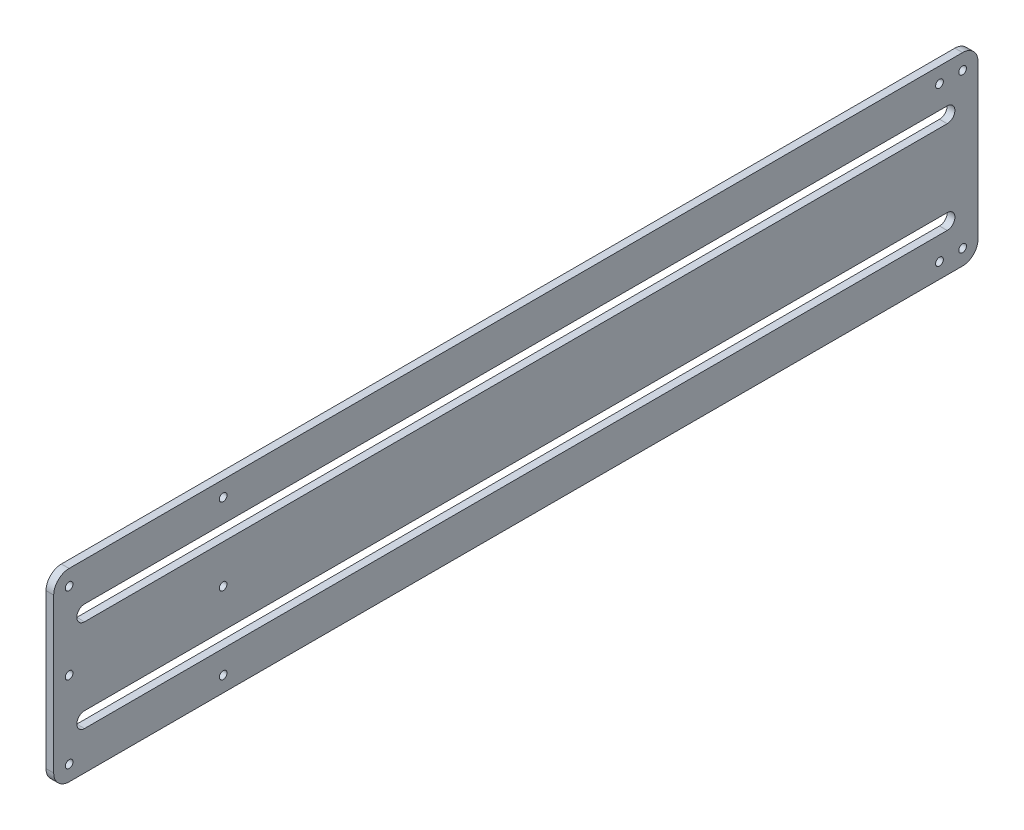
from build123d import *

# Parameters (mm, degrees)
OUTER_CUT_DEPTH    = 1.5875
SLOTS_DEPTH        = 195.298586266
SKETCH3_R          = 1.5875
MOUNT_HOLES_DEPTH  = 195.298586266
SKETCH4_R          = 1.5875
CUT_EXTRUDE1_DEPTH = 195.298586266


with BuildPart() as part:
    # Sketch1 → Outer Cut (new, symmetric)
    with BuildSketch(Plane(origin=(0, 0, 0), x_dir=(0, 0, -1), z_dir=(1, 0, 0))):
        with BuildLine():
            Line((-184.15, -38.1), (184.15, -38.1))
            ThreePointArc((184.15, -38.1), (188.640128061, -36.240128061), (190.5, -31.75))
            Line((190.5, -31.75), (190.5, 31.75))
            ThreePointArc((190.5, 31.75), (188.640128061, 36.240128061), (184.15, 38.1))
            Line((184.15, 38.1), (-184.15, 38.1))
            ThreePointArc((-184.15, 38.1), (-188.640128061, 36.240128061), (-190.5, 31.75))
            Line((-190.5, 31.75), (-190.5, -31.75))
            ThreePointArc((-190.5, -31.75), (-188.640128061, -36.240128061), (-184.15, -38.1))
        make_face()
    extrude(amount=OUTER_CUT_DEPTH, both=True)

    # Sketch2 → Slots (cut, through all)
    with BuildSketch(Plane(origin=(1.5875, 0, 0), x_dir=(0, 0, -1), z_dir=(1, 0, 0))):
        with BuildLine():
            Line((-177.8, 22.225), (177.8, 22.225))
            ThreePointArc((177.8, 22.225), (180.975, 19.05), (177.8, 15.875))
            Line((177.8, 15.875), (-177.8, 15.875))
            ThreePointArc((-177.8, 15.875), (-180.975, 19.05), (-177.8, 22.225))
        make_face()
        with BuildLine():
            Line((-177.8, -22.225), (177.8, -22.225))
            ThreePointArc((177.8, -22.225), (180.975, -19.05), (177.8, -15.875))
            Line((177.8, -15.875), (-177.8, -15.875))
            ThreePointArc((-177.8, -15.875), (-180.975, -19.05), (-177.8, -22.225))
        make_face()
    extrude(amount=-SLOTS_DEPTH, mode=Mode.SUBTRACT)

    # Sketch3 → Mount Holes (cut, through all)
    with BuildSketch(Plane(origin=(1.5875, 0, 0), x_dir=(0, 0, -1), z_dir=(1, 0, 0))):
        with Locations((-184.15, 31.75)):
            Circle(SKETCH3_R)
        with Locations((-120.65, 31.75)):
            Circle(SKETCH3_R)
        with Locations(Location((-120.65, -31.75, 0), (0, 0, 180))):
            Circle(SKETCH3_R)
        with Locations(Location((-184.15, -31.75, 0), (0, 0, 180))):
            Circle(SKETCH3_R)
        with Locations((-184.15, 0)):
            Circle(SKETCH3_R)
        with Locations((-120.65, 0)):
            Circle(SKETCH3_R)
    extrude(amount=-MOUNT_HOLES_DEPTH, mode=Mode.SUBTRACT)

    # Sketch4 → Cut-Extrude1 (cut, through all)
    with BuildSketch(Plane(origin=(1.5875, 0, 0), x_dir=(0, 0, -1), z_dir=(1, 0, 0))):
        with Locations((184.15, 31.75)):
            Circle(SKETCH4_R)
        with Locations((174.625, 31.75)):
            Circle(SKETCH4_R)
        with Locations(Location((174.625, -31.75, 0), (0, 0, 180))):
            Circle(SKETCH4_R)
        with Locations(Location((184.15, -31.75, 0), (0, 0, 180))):
            Circle(SKETCH4_R)
    extrude(amount=-CUT_EXTRUDE1_DEPTH, mode=Mode.SUBTRACT)


solid = part.part
